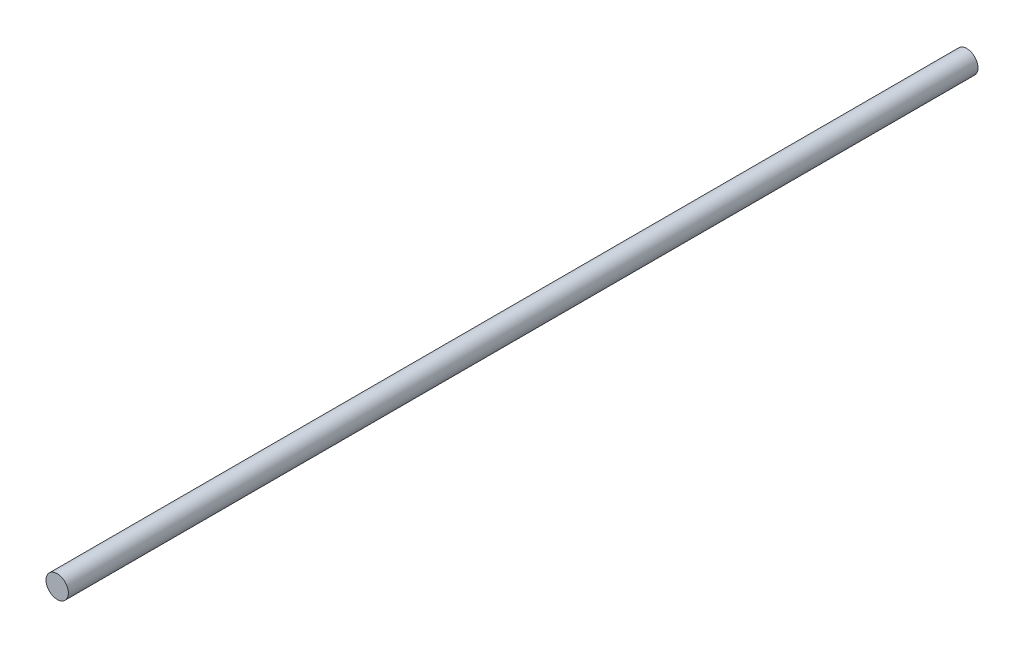
from build123d import *

# Parameters (mm, degrees)
SKETCH1_R           = 3.175
BOSS_EXTRUDE1_DEPTH = 258.091653969


with BuildPart() as part:
    # Sketch1 → Boss-Extrude1 (new body)
    with BuildSketch(Plane.XY):
        Circle(SKETCH1_R)
    extrude(amount=BOSS_EXTRUDE1_DEPTH)


solid = part.part
